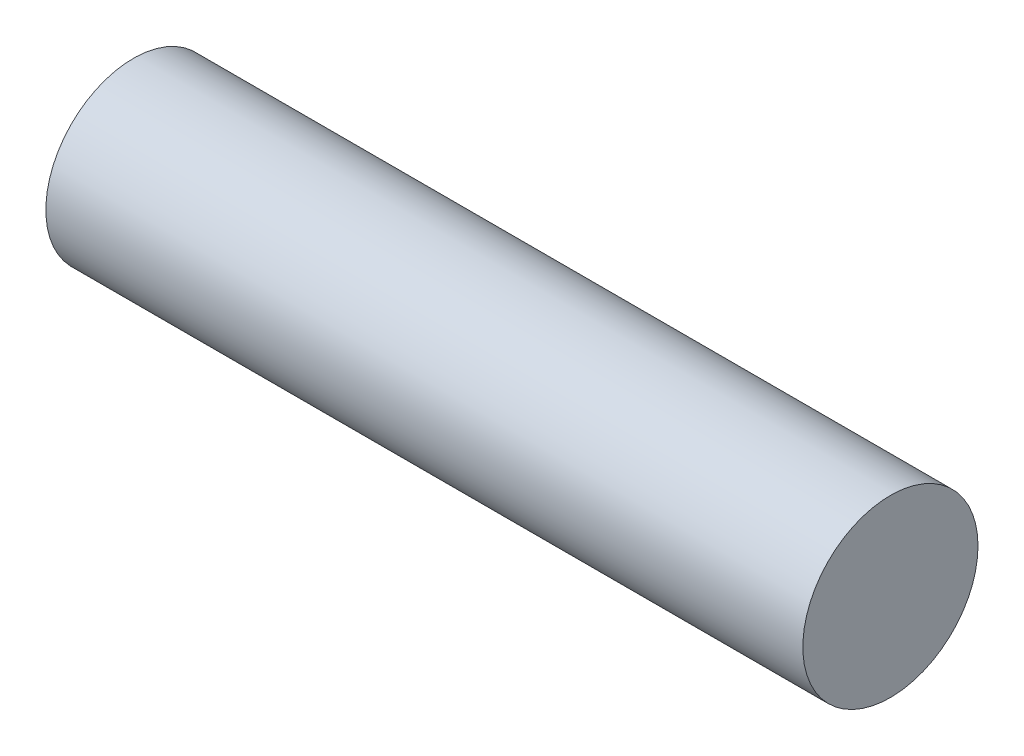
from build123d import *

# Parameters (mm, degrees)
SKETCH1_R           = 4.975
BOSS_EXTRUDE1_DEPTH = 43


with BuildPart() as part:
    # Sketch1 → Boss-Extrude1 (new body)
    with BuildSketch(Plane(origin=(0, 0, 0), x_dir=(0, 0, -1), z_dir=(1, 0, 0))):
        Circle(SKETCH1_R)
    extrude(amount=BOSS_EXTRUDE1_DEPTH)


solid = part.part
